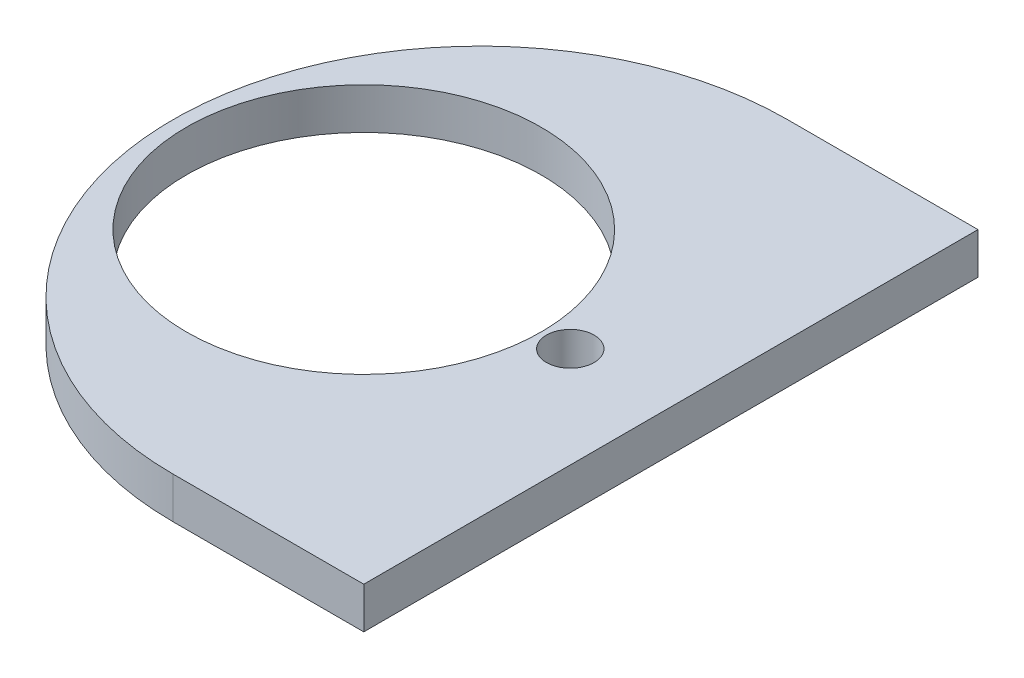
from build123d import *

# Parameters (mm, degrees)
SKETCH1_R           = 33.5
SKETCH1_R_2         = 4.5
BOSS_EXTRUDE1_DEPTH = 7.8


with BuildPart() as part:
    # Sketch1 → Boss-Extrude1 (new body)
    with BuildSketch(Plane(origin=(0, 0, 0), x_dir=(1, 0, 0), z_dir=(0, 1, 0))):
        with BuildLine():
            Line((0, 0), (36, 0))
            Line((36, 0), (36, -116))
            Line((36, -116), (0, -116))
            ThreePointArc((0, -116), (-58, -58), (0, 0))
        make_face()
        with Locations(Location((-22, -58, 0), (0, 0, 270))):
            Circle(SKETCH1_R, mode=Mode.SUBTRACT)
        with Locations(Location((17, -58, 0), (0, 0, 270))):
            Circle(SKETCH1_R_2, mode=Mode.SUBTRACT)
    extrude(amount=BOSS_EXTRUDE1_DEPTH)


solid = part.part
